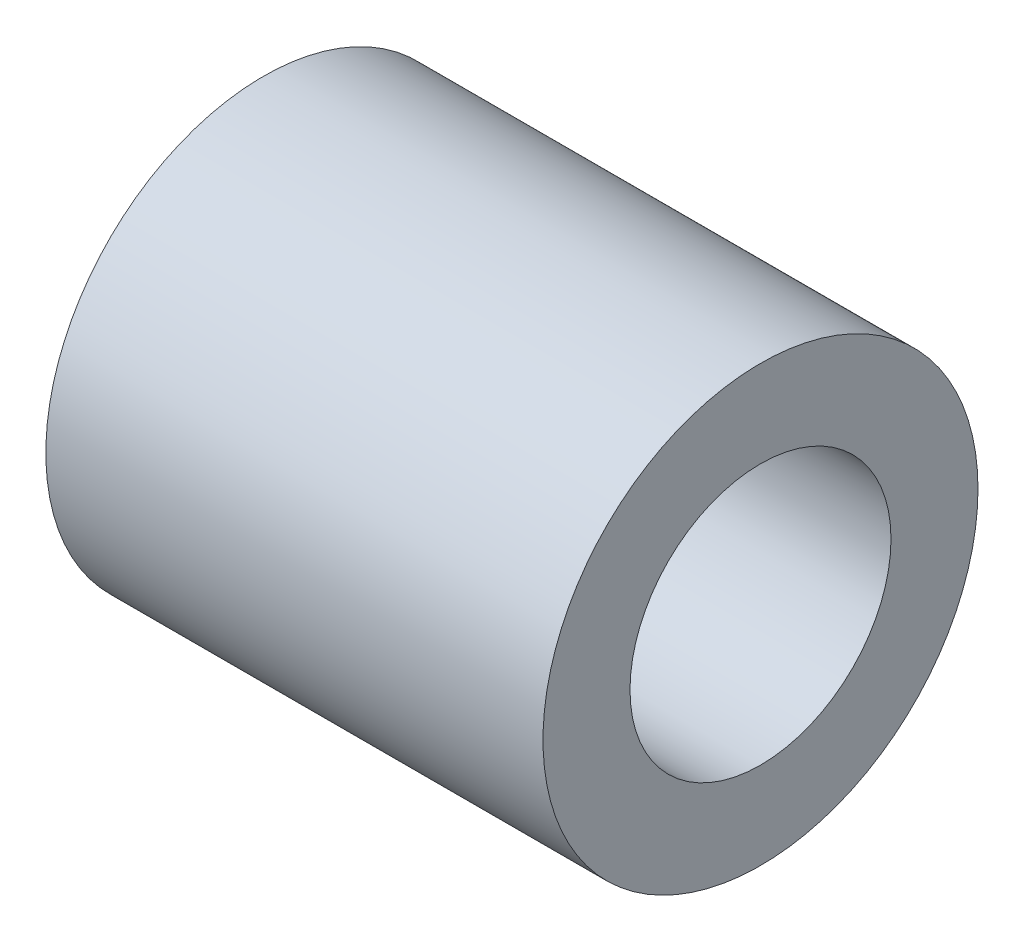
from build123d import *

# Parameters (mm, degrees)
SKETCH_1_R      = 3.5
SKETCH_1_R_2    = 2.1
EXTRUDE_1_DEPTH = 4


with BuildPart() as part:
    # 草图1 → 凸台-拉伸1 (new, symmetric)
    with BuildSketch(Plane(origin=(0, 0, 0), x_dir=(0, -1, 0), z_dir=(1, 0, 0))):
        with Locations(Location((0, 0, 0), (0, 0, 90))):
            Circle(SKETCH_1_R)
        with Locations(Location((0, 0, 0), (0, 0, 90))):
            Circle(SKETCH_1_R_2, mode=Mode.SUBTRACT)
    extrude(amount=EXTRUDE_1_DEPTH, both=True)


solid = part.part
